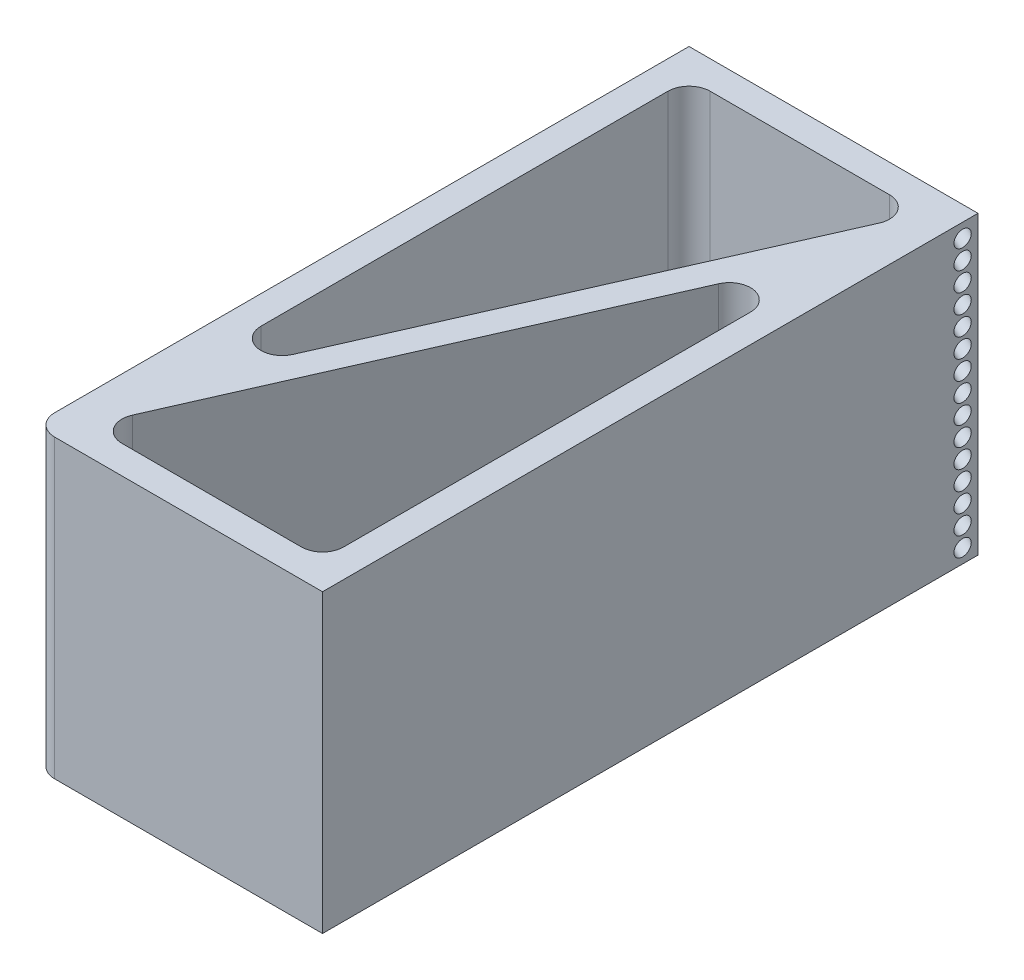
from build123d import *

# Parameters (mm, degrees)
SKETCH1_W               = 41
SKETCH1_H               = 93
BOSS_EXTRUDE1_DEPTH     = 42
CUT_EXTRUDE1_DEPTH      = 66.927991021
CUT_EXTRUDE1_DEPTH_BACK = 66.927991021
SKETCH2_R               = 1.125
CUT_EXTRUDE2_DEPTH      = 66.927991021
FILLET1_R               = 3
FILLET2_R               = 3


with BuildPart() as part:
    # Sketch1 → Boss-Extrude1 (new body)
    with BuildSketch(Plane(origin=(0, 0, 0), x_dir=(1, 0, 0), z_dir=(0, 1, 0))):
        Rectangle(SKETCH1_W, SKETCH1_H)
    extrude(amount=BOSS_EXTRUDE1_DEPTH)

    # Sketch2 → Cut-Extrude1 (cut, two sides: drawn at the far end of the back side and taken through both)
    with BuildSketch(Plane(origin=(0, 0, 0), x_dir=(-0.403397958441935, 0, 0.9150246374414619), z_dir=(-0.9150246374414619, 0, -0.403397958441935)).offset(-CUT_EXTRUDE1_DEPTH_BACK)):
        with Locations((-48.818303789, 40)):
            Circle(SKETCH2_R)
        with Locations((-48.818303789, 37.285714286)):
            Circle(SKETCH2_R)
        with Locations((-48.818303789, 34.571428571)):
            Circle(SKETCH2_R)
        with Locations((-48.818303789, 31.857142857)):
            Circle(SKETCH2_R)
        with Locations((-48.818303789, 29.142857143)):
            Circle(SKETCH2_R)
        with Locations((-48.818303789, 26.428571429)):
            Circle(SKETCH2_R)
        with Locations((-48.818303789, 23.714285714)):
            Circle(SKETCH2_R)
        with Locations((-48.818303789, 21)):
            Circle(SKETCH2_R)
        with Locations((-48.818303789, 18.285714286)):
            Circle(SKETCH2_R)
        with Locations((-48.818303789, 15.571428571)):
            Circle(SKETCH2_R)
        with Locations((-48.818303789, 12.857142857)):
            Circle(SKETCH2_R)
        with Locations((-48.818303789, 10.142857143)):
            Circle(SKETCH2_R)
        with Locations((-48.818303789, 7.428571429)):
            Circle(SKETCH2_R)
        with Locations((-48.818303789, 4.714285714)):
            Circle(SKETCH2_R)
        with Locations((-48.818303789, 2)):
            Circle(SKETCH2_R)
    extrude(amount=CUT_EXTRUDE1_DEPTH + CUT_EXTRUDE1_DEPTH_BACK, mode=Mode.SUBTRACT)

    # Sketch3 → Cut-Extrude2 (cut, through all)
    with BuildSketch(Plane.XZ):
        Polygon((16.5, 42.5), (-16.550825643, 42.5), (16.5, -32.468945972), align=None)
        Polygon((-16.5, 32.468945972), (16.550825643, -42.5), (-16.5, -42.5), align=None)
    extrude(amount=-CUT_EXTRUDE2_DEPTH, mode=Mode.SUBTRACT)

    # Fillet1
    fillet1_edges = [part.edges().sort_by_distance(p)[0] for p in [
        (-16.5, 21, -42.5),
        (-16.5, 21, 32.468945972),
        (16.550825643, 21, -42.5),
        (16.5, 21, 42.5),
        (16.5, 21, -32.468945972),
        (-16.550825643, 21, 42.5),
    ]]
    fillet(fillet1_edges, radius=FILLET1_R)

    # Fillet2
    fillet2_edges = [part.edges().sort_by_distance(p)[0] for p in [
        (-20.5, 21, 46.5),
    ]]
    fillet(fillet2_edges, radius=FILLET2_R)


solid = part.part
